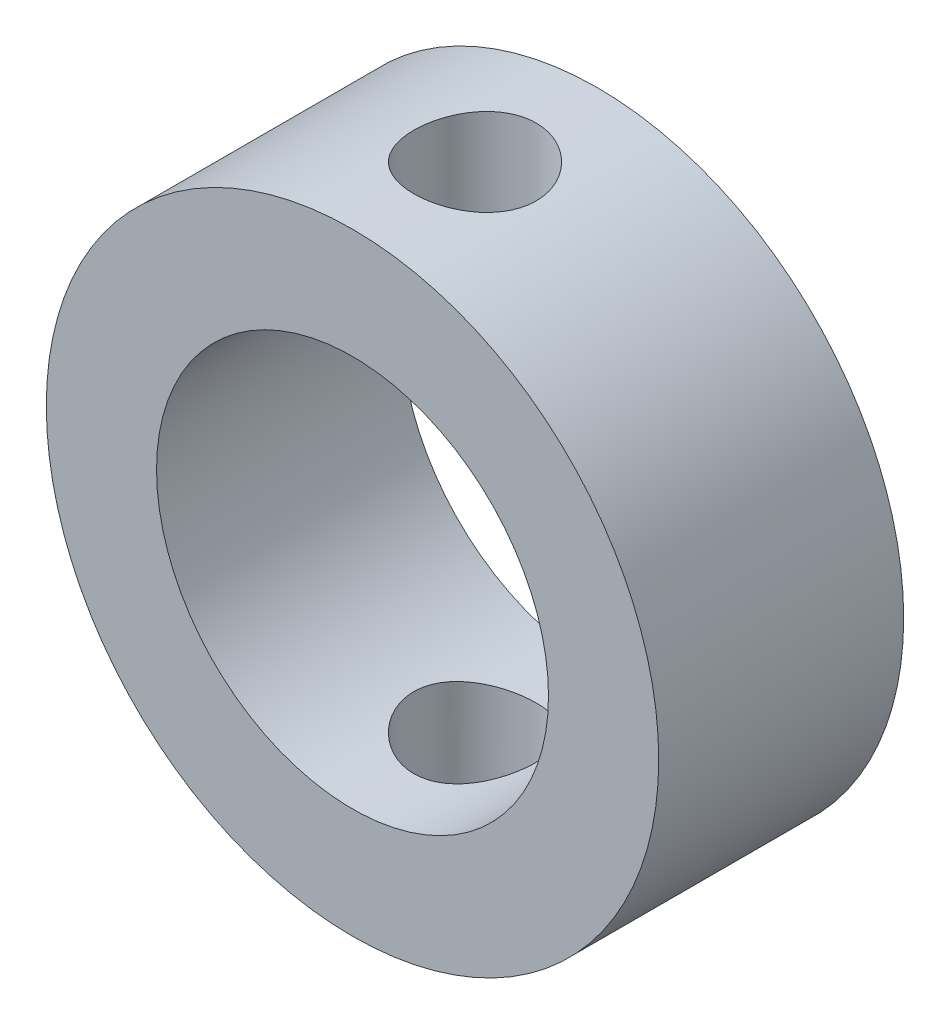
from build123d import *

# Parameters (mm, degrees)
SKETCH1_R           = 12.5
SKETCH1_R_2         = 8
BOSS_EXTRUDE1_DEPTH = 10
SKETCH2_R           = 2.5
CUT_EXTRUDE1_DEPTH  = 50


with BuildPart() as part:
    # Sketch1 → Boss-Extrude1 (new body)
    with BuildSketch(Plane.XY):
        Circle(SKETCH1_R)
        Circle(SKETCH1_R_2, mode=Mode.SUBTRACT)
    extrude(amount=BOSS_EXTRUDE1_DEPTH)

    # Sketch2 → Cut-Extrude1 (cut, symmetric)
    with BuildSketch(Plane(origin=(0, 0, 0), x_dir=(1, 0, 0), z_dir=(0, 1, 0))):
        with Locations(Location((0, -5, 0), (0, 0, 270))):
            Circle(SKETCH2_R)
    extrude(amount=CUT_EXTRUDE1_DEPTH, both=True, mode=Mode.SUBTRACT)


solid = part.part
